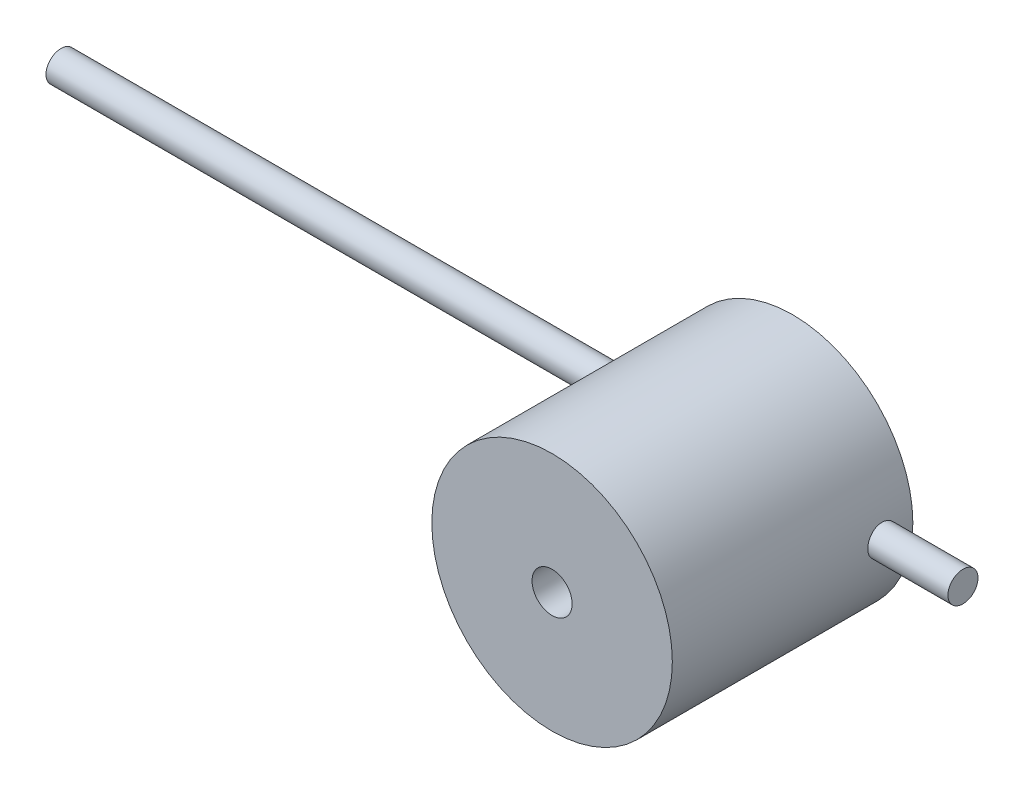
from build123d import *

# Parameters (mm, degrees)
SKETCH_1_R          = 60
EXTRUDE_1_DEPTH     = 120
SKETCH_3_R          = 7.5
EXTRUDE_3_DEPTH     = 350
SKETCH_4_R          = 10
CUT_EXTRUDE_1_DEPTH = 375.833296421
EXTRUDE_START       = 100
SKETCH_3_2_R        = 7.5
EXTRUDE_4_DEPTH     = 70


with BuildPart() as part:
    # 草图1 → 凸台-拉伸1 (new body)
    with BuildSketch(Plane.XY):
        Circle(SKETCH_1_R)
    extrude(amount=EXTRUDE_1_DEPTH)

    # 草图3 → 凸台-拉伸3 (add)
    with BuildSketch(Plane(origin=(0, 0, 0), x_dir=(0, 0, -1), z_dir=(1, 0, 0))):
        with Locations((-15, 0)):
            Circle(SKETCH_3_R)
    extrude(amount=-EXTRUDE_3_DEPTH)

    # 草图4 → 切除-拉伸1 (cut, through all)
    with BuildSketch(Plane.XY.offset(120)):
        Circle(SKETCH_4_R)
    extrude(amount=-CUT_EXTRUDE_1_DEPTH, mode=Mode.SUBTRACT)

    # 草图3<2> → 凸台-拉伸4 (add)
    with BuildSketch(Plane(origin=(0, 0, 0), x_dir=(0, 0, -1), z_dir=(1, 0, 0)).offset(EXTRUDE_START)):
        with Locations((-15, 0)):
            Circle(SKETCH_3_2_R)
    extrude(amount=-EXTRUDE_4_DEPTH)


solid = part.part
